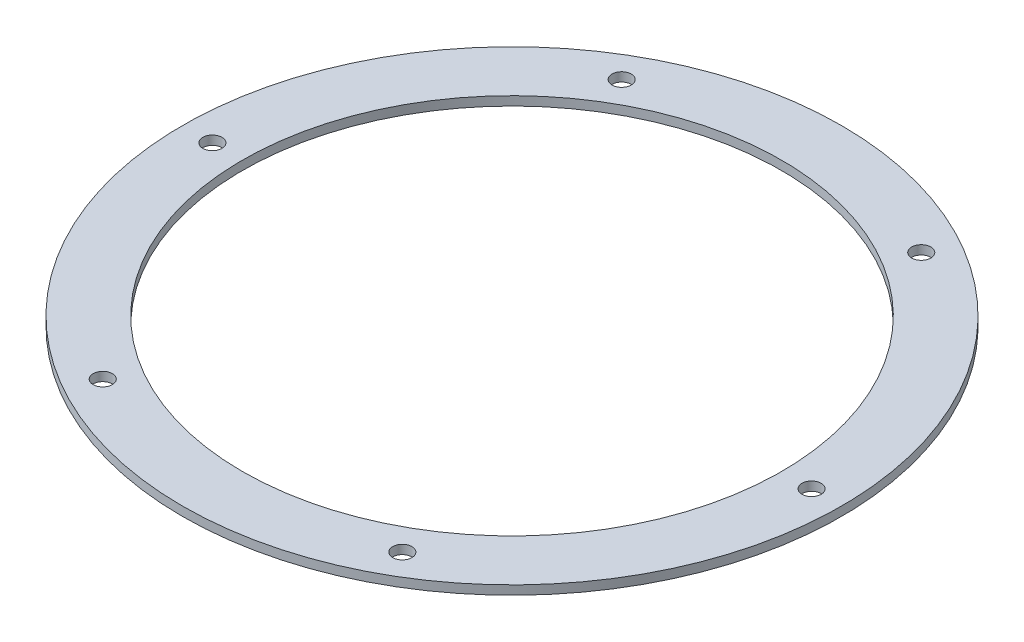
from build123d import *

# Parameters (mm, degrees)
SKETCH_1_R      = 55
SKETCH_1_R_2    = 45
SKETCH_1_R_3    = 1.6
EXTRUDE_1_DEPTH = 1.5


with BuildPart() as part:
    # 草图1 → 凸台-拉伸1 (new body)
    with BuildSketch(Plane(origin=(0, 0, 0), x_dir=(1, 0, 0), z_dir=(0, 1, 0))):
        with Locations(Location((0, 0, 0), (0, 0, 270))):
            Circle(SKETCH_1_R)
        with Locations(Location((0, 0, 0), (0, 0, 270))):
            Circle(SKETCH_1_R_2, mode=Mode.SUBTRACT)
        with Locations(Location((50, 0, 0), (0, 0, 270))):
            Circle(SKETCH_1_R_3, mode=Mode.SUBTRACT)
        with Locations(Location((25, -43.301270189, 0), (0, 0, 270))):
            Circle(SKETCH_1_R_3, mode=Mode.SUBTRACT)
        with Locations(Location((-25, -43.301270189, 0), (0, 0, 270))):
            Circle(SKETCH_1_R_3, mode=Mode.SUBTRACT)
        with Locations(Location((-50, 0, 0), (0, 0, 270))):
            Circle(SKETCH_1_R_3, mode=Mode.SUBTRACT)
        with Locations(Location((-25, 43.301270189, 0), (0, 0, 270))):
            Circle(SKETCH_1_R_3, mode=Mode.SUBTRACT)
        with Locations(Location((25, 43.301270189, 0), (0, 0, 270))):
            Circle(SKETCH_1_R_3, mode=Mode.SUBTRACT)
    extrude(amount=EXTRUDE_1_DEPTH)


solid = part.part
